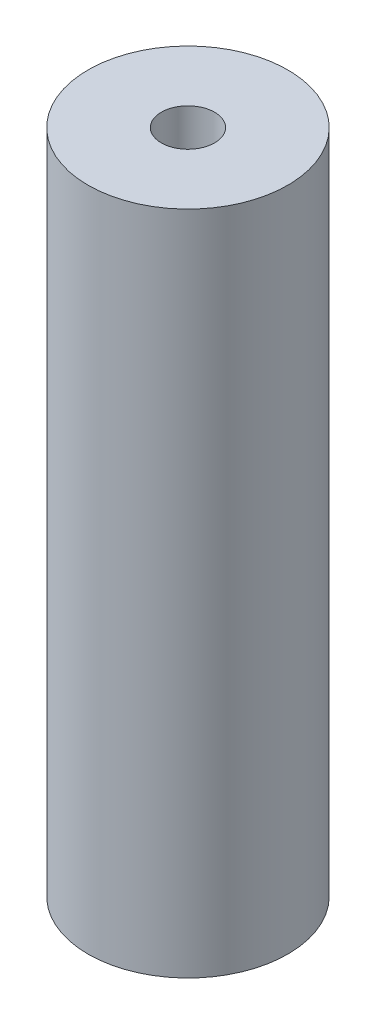
from build123d import *

# Parameters (mm, degrees)
SKETCH_1_R      = 7.5
SKETCH_1_R_2    = 2
EXTRUDE_1_DEPTH = 50


with BuildPart() as part:
    # ｽｹｯﾁ1 → ﾎﾞｽ - 押し出し1 (new body)
    with BuildSketch(Plane(origin=(0, 0, 0), x_dir=(1, 0, 0), z_dir=(0, 1, 0))):
        with Locations(Location((0, 0, 0), (0, 0, 270))):
            Circle(SKETCH_1_R)
        with Locations(Location((0, 0, 0), (0, 0, 270))):
            Circle(SKETCH_1_R_2, mode=Mode.SUBTRACT)
    extrude(amount=EXTRUDE_1_DEPTH)


solid = part.part
